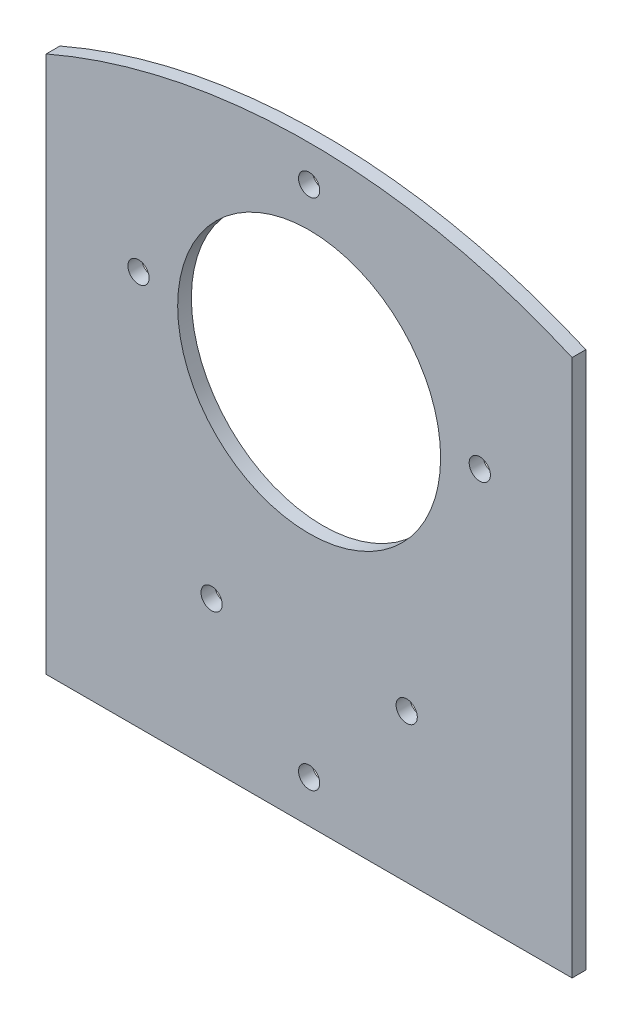
from build123d import *

# Parameters (mm, degrees)
SKETCH1_W           = 70
SKETCH1_H           = 105
BOSS_EXTRUDE1_DEPTH = 2
SKETCH2_R           = 17.5
CUT_EXTRUDE3_DEPTH  = 3
CUT_EXTRUDE6_DEPTH  = 10
SCALE1_SCALE        = 1.771428571
SKETCH6_R           = 30.999999993
CUT_EXTRUDE7_DEPTH  = 0.31
SKETCH7_W           = 123.99999997
SKETCH7_H           = 38.57142855
CUT_EXTRUDE8_DEPTH  = 10
SKETCH9_R           = 2.5
CUT_EXTRUDE9_DEPTH  = 3.232857142
SKETCH10_R          = 2.5
CUT_EXTRUDE10_DEPTH = 3.232857142


with BuildPart() as part:
    # Sketch1 → Boss-Extrude1 (new body)
    with BuildSketch(Plane.XY):
        Rectangle(SKETCH1_W, SKETCH1_H)
    extrude(amount=BOSS_EXTRUDE1_DEPTH)

    # Sketch2 → Cut-Extrude3 (cut)
    with BuildSketch(Plane(origin=(0, 0, 0), x_dir=(-1, 0, 0), z_dir=(0, 0, -1))):
        with Locations((0, 20.5)):
            Circle(SKETCH2_R)
    extrude(amount=-CUT_EXTRUDE3_DEPTH, mode=Mode.SUBTRACT)

    # Sketch5 → Cut-Extrude6 (cut)
    with BuildSketch(Plane.XY.offset(2)):
        with BuildLine():
            Line((-35, 40.793543502), (-35, 52.5))
            Line((-35, 52.5), (35, 52.5))
            Line((35, 52.5), (35, 40.793543502))
            ThreePointArc((35, 40.793543502), (0, 48.07644174), (-35, 40.793543502))
        make_face()
    extrude(amount=-CUT_EXTRUDE6_DEPTH, mode=Mode.SUBTRACT)


with BuildPart() as part_1:
    # Scale1: scaled about (0, -7.267874882, 1)
    add(part.part.scale(SCALE1_SCALE).moved(Location((0, 5.606646334, -0.771428571))))

    # Sketch6 → Cut-Extrude7 (cut)
    with BuildSketch(Plane(origin=(0, 0, -0.771428571), x_dir=(-1, 0, 0), z_dir=(0, 0, -1))):
        with BuildLine():
            Line((61.999999985, -87.393353643), (61.999999985, 77.869494806))
            ThreePointArc((61.999999985, 77.869494806), (0, 90.770628825), (-61.999999985, 77.869494806))
            Line((-61.999999985, 77.869494806), (-61.999999985, -87.393353643))
            Line((-61.999999985, -87.393353643), (61.999999985, -87.393353643))
        make_face()
        with Locations((0, 41.92093204)):
            Circle(SKETCH6_R, mode=Mode.SUBTRACT)
    extrude(amount=-CUT_EXTRUDE7_DEPTH, mode=Mode.SUBTRACT)

    # Sketch7 → Cut-Extrude8 (cut)
    with BuildSketch(Plane.XY.offset(2.771428571)):
        with Locations((0, -68.107639368)):
            Rectangle(SKETCH7_W, SKETCH7_H)
    extrude(amount=-CUT_EXTRUDE8_DEPTH, mode=Mode.SUBTRACT)

    # Sketch9 → Cut-Extrude9 (cut)
    with BuildSketch(Plane.XY.offset(2.771428571)):
        with Locations((0, -38.821925093)):
            Circle(SKETCH9_R)
        with Locations((-23, -13.821925093)):
            Circle(SKETCH9_R)
        with Locations(Location((23, -13.821925093, 0), (0, 0, 180))):
            Circle(SKETCH9_R)
    extrude(amount=-CUT_EXTRUDE9_DEPTH, mode=Mode.SUBTRACT)

    # Sketch10 → Cut-Extrude10 (cut)
    with BuildSketch(Plane.XY.offset(2.771428571)):
        with Locations((-40.233402491, 44.236817184)):
            Circle(SKETCH10_R)
        with Locations((0, 82.22093204)):
            Circle(SKETCH10_R)
        with Locations((40.233400771, 44.236847056)):
            Circle(SKETCH10_R)
    extrude(amount=-CUT_EXTRUDE10_DEPTH, mode=Mode.SUBTRACT)


solid = part_1.part
